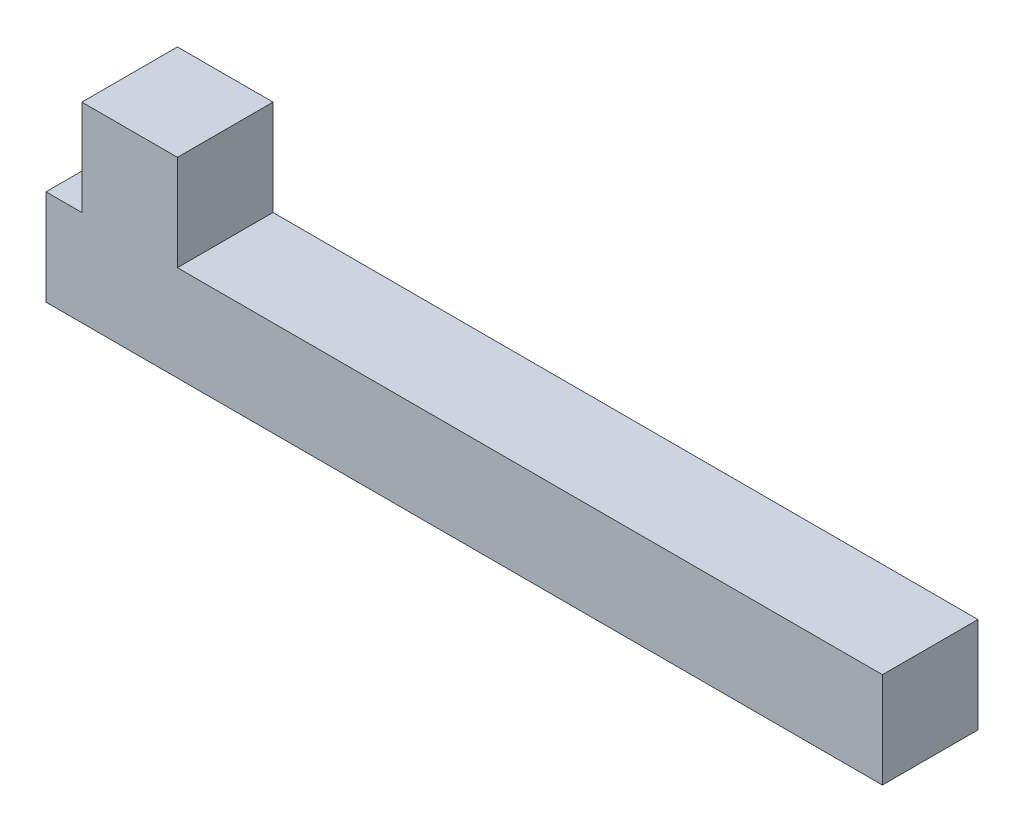
from build123d import *

# Parameters (mm, degrees)
BOSS_EXTRU_1_DEPTH = 4


with BuildPart() as part:
    # Esquisse1 → Boss.-Extru.1 (new body)
    with BuildSketch(Plane.XY):
        Polygon((0, 0), (0, 4), (1.5, 4), (1.5, 8), (5.5, 8), (5.5, 4), (35, 4), (35, 0), align=None)
    extrude(amount=BOSS_EXTRU_1_DEPTH)


solid = part.part
